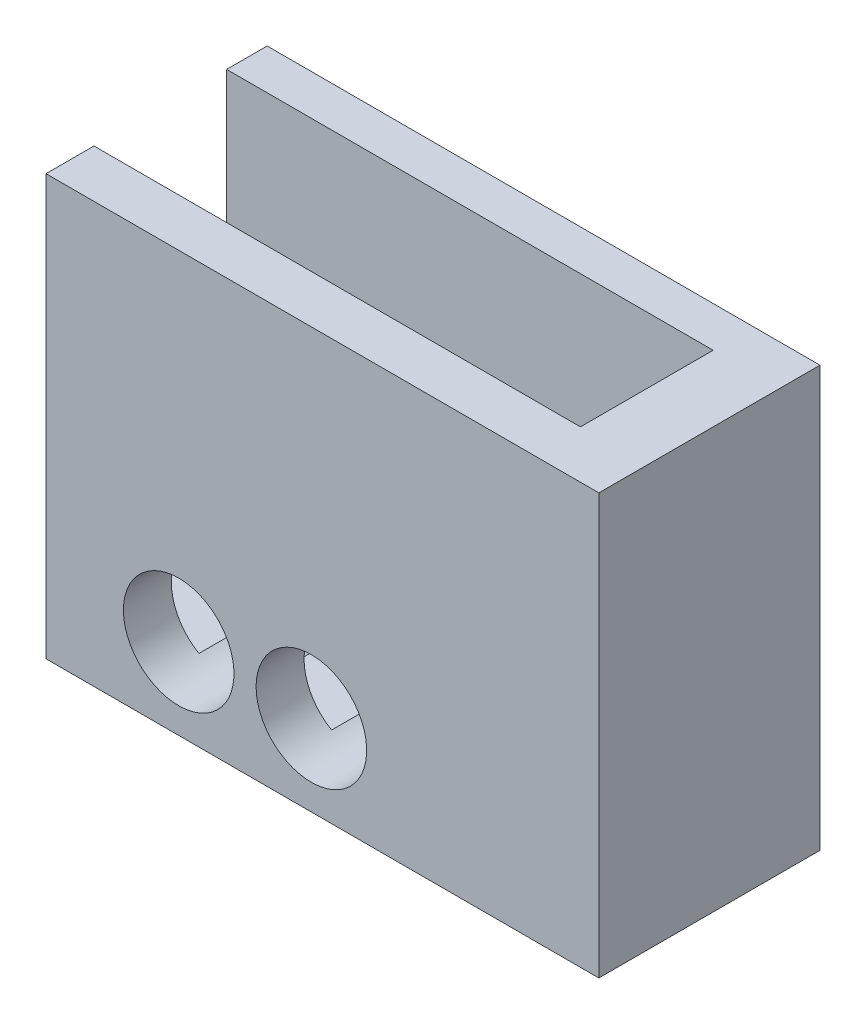
from build123d import *

# Parameters (mm, degrees)
SKETCH_1_W          = 25
SKETCH_1_H          = 10
EXTRUDE_2_DEPTH     = 19
SKETCH_2_W          = 22
SKETCH_2_H          = 6
CUT_EXTRUDE_1_DEPTH = 17.5
SKETCH_3_R          = 2.5
CUT_EXTRUDE_2_DEPTH = 20


with BuildPart() as part:
    # 草圖1 → 填料-伸長2 (new body)
    with BuildSketch(Plane(origin=(0, 0, 0), x_dir=(1, 0, 0), z_dir=(0, 1, 0))):
        with Locations((5.208333333, 1.1625)):
            Rectangle(SKETCH_1_W, SKETCH_1_H)
    extrude(amount=EXTRUDE_2_DEPTH)

    # 草圖2 → 除料-伸長1 (cut)
    with BuildSketch(Plane(origin=(0, 19, 0), x_dir=(1, 0, 0), z_dir=(0, 1, 0))):
        with Locations((3.708333333, 1.330875321)):
            Rectangle(SKETCH_2_W, SKETCH_2_H)
    extrude(amount=-CUT_EXTRUDE_1_DEPTH, mode=Mode.SUBTRACT)

    # 草圖3 → 除料-伸長2 (cut)
    with BuildSketch(Plane(origin=(0, 0, -6.1625), x_dir=(-1, 0, 0), z_dir=(0, 0, -1))):
        with Locations((-4.708333333, 3.663194133)):
            Circle(SKETCH_3_R)
        with Locations((1.291666667, 3.663194133)):
            Circle(SKETCH_3_R)
    extrude(amount=-CUT_EXTRUDE_2_DEPTH, mode=Mode.SUBTRACT)


solid = part.part
